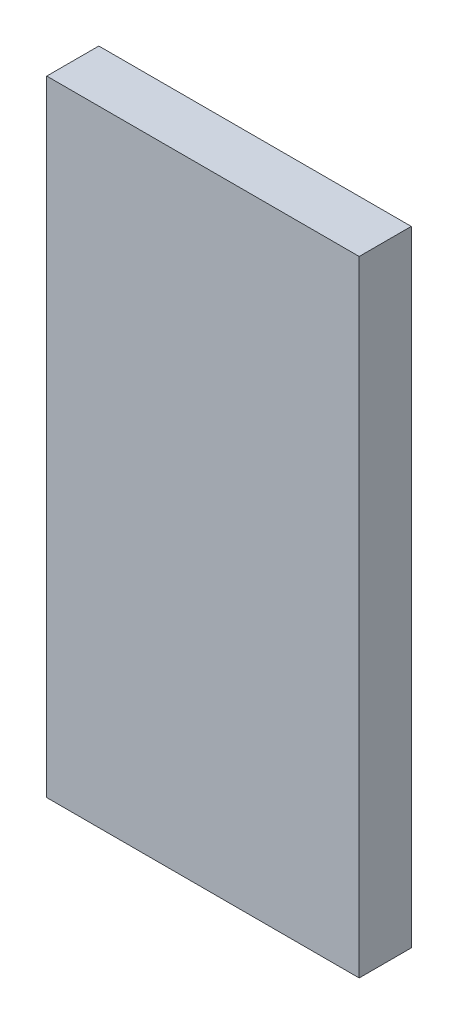
from build123d import *

# Parameters (mm, degrees)
SKETCH1_W           = 76.2
SKETCH1_H           = 152.4
BOSS_EXTRUDE1_DEPTH = 12.7


with BuildPart() as part:
    # Sketch1 → Boss-Extrude1 (new body)
    with BuildSketch(Plane.XY):
        with Locations((-50.8, 1104.9)):
            Rectangle(SKETCH1_W, SKETCH1_H)
    extrude(amount=BOSS_EXTRUDE1_DEPTH)


solid = part.part
